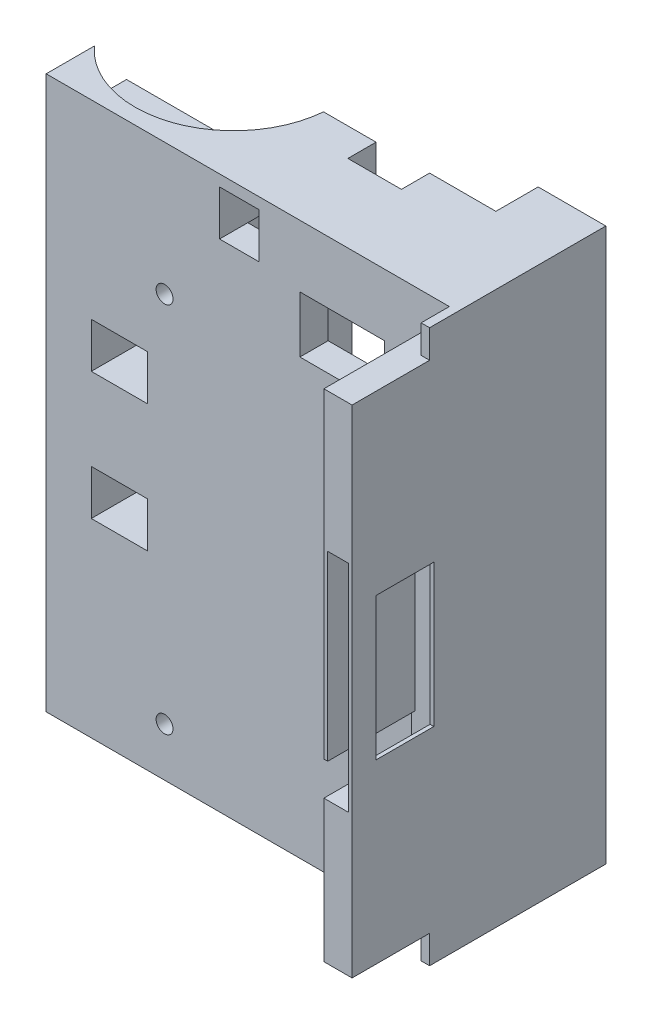
from build123d import *

# Parameters (mm, degrees)
SKETCH1_W           = 72
SKETCH1_H           = 26.25
BOSS_EXTRUDE1_DEPTH = 98
SKETCH3_W           = 24
SKETCH3_H           = 12
CUT_EXTRUDE2_DEPTH  = 98
SKETCH4_W           = 1
SKETCH4_H           = 14.25
BOSS_EXTRUDE2_DEPTH = 98
SKETCH8_R           = 17.5
CUT_EXTRUDE6_DEPTH  = 8
CUT_EXTRUDE7_START  = -8
SKETCH9_R           = 17.5
CUT_EXTRUDE7_DEPTH  = 8
SKETCH10_R          = 2.25
CUT_EXTRUDE8_DEPTH  = 4.25
SKETCH11_W          = 33
SKETCH11_H          = 67.5
CUT_EXTRUDE9_DEPTH  = 21.25
SKETCH12_W          = 33
SKETCH12_H          = 7.5
CUT_EXTRUDE10_DEPTH = 21.25
SKETCH13_W          = 9.5
SKETCH13_H          = 10
CUT_EXTRUDE11_DEPTH = 21.25
SKETCH14_W          = 5
SKETCH14_H          = 5
CUT_EXTRUDE13_DEPTH = 101.25
SKETCH17_W          = 7
SKETCH17_H          = 8
CUT_EXTRUDE14_DEPTH = 7
SKETCH18_W          = 5.398243629
SKETCH18_H          = 5.439982626
BOSS_EXTRUDE3_DEPTH = 2
SKETCH19_W          = 15
SKETCH19_H          = 15
CUT_EXTRUDE15_DEPTH = 12
SKETCH20_W          = 15.253773686
SKETCH20_H          = 5.298590198
BOSS_EXTRUDE5_DEPTH = 5
SKETCH22_R          = 1.5
CUT_EXTRUDE16_DEPTH = 8.2
SKETCH23_W          = 10
SKETCH23_H          = 8
CUT_EXTRUDE18_DEPTH = 125.988249448
SKETCH25_R          = 2.25
CUT_EXTRUDE20_DEPTH = 6.25
SKETCH26_W          = 7
SKETCH26_H          = 8
CUT_EXTRUDE21_DEPTH = 124.057913195
SKETCH28_W          = 7.366793482
SKETCH28_H          = 8.135980894
BOSS_EXTRUDE6_DEPTH = 2
SKETCH31_R          = 1.5
CUT_EXTRUDE24_DEPTH = 3.25
SKETCH32_W          = 5
SKETCH32_H          = 98
BOSS_EXTRUDE7_DEPTH = 18.75
SKETCH34_W          = 5
SKETCH34_H          = 5
CUT_EXTRUDE27_DEPTH = 13.75
SKETCH35_W          = 3.5
SKETCH35_H          = 5
CUT_EXTRUDE28_DEPTH = 5
SKETCH37_W          = 10.25
SKETCH37_H          = 25.25
CUT_EXTRUDE29_DEPTH = 3
SKETCH36_W          = 3.65
SKETCH36_H          = 38.25
CUT_EXTRUDE30_DEPTH = 15.5
SKETCH38_W          = 0.68
SKETCH38_H          = 6
CUT_EXTRUDE31_DEPTH = 15.5


with BuildPart() as part:
    # Sketch1 → Boss-Extrude1 (new body)
    with BuildSketch(Plane(origin=(0, 0, 0), x_dir=(1, 0, 0), z_dir=(0, 1, 0))):
        with Locations((-36, -13.125)):
            Rectangle(SKETCH1_W, SKETCH1_H)
    extrude(amount=BOSS_EXTRUDE1_DEPTH)

    # Sketch3 → Cut-Extrude2 (cut)
    with BuildSketch(Plane.XZ):
        with Locations((-60, 6)):
            Rectangle(SKETCH3_W, SKETCH3_H)
    extrude(amount=-CUT_EXTRUDE2_DEPTH, mode=Mode.SUBTRACT)

    # Sketch4 → Boss-Extrude2 (add)
    with BuildSketch(Plane(origin=(0, 0, 0), x_dir=(-1, 0, 0), z_dir=(0, -1, 0))):
        with Locations((72.5, -19.125)):
            Rectangle(SKETCH4_W, SKETCH4_H)
    extrude(amount=-BOSS_EXTRUDE2_DEPTH)

    # Sketch8 → Cut-Extrude6 (cut)
    with BuildSketch(Plane.XZ):
        with Locations((-60, 6)):
            Circle(SKETCH8_R)
    extrude(amount=-CUT_EXTRUDE6_DEPTH, mode=Mode.SUBTRACT)

    # Sketch9 → Cut-Extrude7 (cut)
    with BuildSketch(Plane(origin=(0, 98, 0), x_dir=(1, 0, 0), z_dir=(0, 1, 0)).offset(CUT_EXTRUDE7_START)):
        with Locations((-60, -6)):
            Circle(SKETCH9_R)
    extrude(amount=CUT_EXTRUDE7_DEPTH, mode=Mode.SUBTRACT)

    # Sketch10 → Cut-Extrude8 (cut)
    with BuildSketch(Plane(origin=(0, 0, 12), x_dir=(-1, 0, 0), z_dir=(0, 0, -1))):
        with Locations((69.25, 85)):
            Circle(SKETCH10_R)
        with Locations((50.75, 85)):
            Circle(SKETCH10_R)
        with Locations((69.25, 13)):
            Circle(SKETCH10_R)
        with Locations((50.75, 13)):
            Circle(SKETCH10_R)
    extrude(amount=-CUT_EXTRUDE8_DEPTH, mode=Mode.SUBTRACT)

    # Sketch11 → Cut-Extrude9 (cut)
    with BuildSketch(Plane(origin=(0, 0, 0), x_dir=(-1, 0, 0), z_dir=(0, 0, -1))):
        with Locations((28.5, 54.25)):
            Rectangle(SKETCH11_W, SKETCH11_H)
    extrude(amount=-CUT_EXTRUDE9_DEPTH, mode=Mode.SUBTRACT)

    # Sketch12 → Cut-Extrude10 (cut)
    with BuildSketch(Plane(origin=(0, 98, 0), x_dir=(1, 0, 0), z_dir=(0, 1, 0))):
        with Locations((-28.5, -3.75)):
            Rectangle(SKETCH12_W, SKETCH12_H)
    extrude(amount=-CUT_EXTRUDE10_DEPTH, mode=Mode.SUBTRACT)

    # Sketch13 → Cut-Extrude11 (cut)
    with BuildSketch(Plane(origin=(0, 98, 0), x_dir=(1, 0, 0), z_dir=(0, 1, 0))):
        with Locations((-28.5, -7.5)):
            Rectangle(SKETCH13_W, SKETCH13_H)
    extrude(amount=-CUT_EXTRUDE11_DEPTH, mode=Mode.SUBTRACT)

    # Sketch14 → Cut-Extrude13 (cut)
    with BuildSketch(Plane(origin=(0, 20.5, 0), x_dir=(1, 0, 0), z_dir=(0, 1, 0))):
        with Locations((-39.5, -12)):
            Rectangle(SKETCH14_W, SKETCH14_H)
    extrude(amount=CUT_EXTRUDE13_DEPTH, mode=Mode.SUBTRACT)

    # Sketch17 → Cut-Extrude14 (cut)
    with BuildSketch(Plane(origin=(0, 0, 7.5), x_dir=(-1, 0, 0), z_dir=(0, 0, -1))):
        with Locations((38.75, 92)):
            Rectangle(SKETCH17_W, SKETCH17_H)
    extrude(amount=-CUT_EXTRUDE14_DEPTH, mode=Mode.SUBTRACT)

    # Sketch18 → Boss-Extrude3 (add)
    with BuildSketch(Plane(origin=(0, 98, 0), x_dir=(1, 0, 0), z_dir=(0, 1, 0))):
        with Locations((-39.480706385, -11.994977786)):
            Rectangle(SKETCH18_W, SKETCH18_H)
    extrude(amount=-BOSS_EXTRUDE3_DEPTH)

    # Sketch19 → Cut-Extrude15 (cut)
    with BuildSketch(Plane.XY.offset(26.25)):
        with Locations((-20.5, 79.5)):
            Rectangle(SKETCH19_W, SKETCH19_H)
    extrude(amount=-CUT_EXTRUDE15_DEPTH, mode=Mode.SUBTRACT)

    # Sketch20 → Boss-Extrude5 (add)
    with BuildSketch(Plane.XY.offset(26.25)):
        with Locations((-20.373113157, 74.350704901)):
            Rectangle(SKETCH20_W, SKETCH20_H)
    extrude(amount=-BOSS_EXTRUDE5_DEPTH)

    # Sketch22 → Cut-Extrude16 (cut)
    with BuildSketch(Plane(origin=(0, 0, 0), x_dir=(-1, 0, 0), z_dir=(0, 0, -1))):
        with Locations((6, 55.73)):
            Circle(SKETCH22_R)
        with Locations((6, 42.27)):
            Circle(SKETCH22_R)
    extrude(amount=-CUT_EXTRUDE16_DEPTH, mode=Mode.SUBTRACT)

    # Sketch23 → Cut-Extrude18 (cut, through all)
    with BuildSketch(Plane.XY.offset(26.25)):
        with Locations((-60, 37.7)):
            Rectangle(SKETCH23_W, SKETCH23_H)
        with Locations((-60, 60.3)):
            Rectangle(SKETCH23_W, SKETCH23_H)
    extrude(amount=-CUT_EXTRUDE18_DEPTH, mode=Mode.SUBTRACT)

    # Sketch25 → Cut-Extrude20 (cut)
    with BuildSketch(Plane.ZY.offset(73)):
        with Locations((19.125, 77)):
            Circle(SKETCH25_R)
        with Locations((19.125, 49)):
            Circle(SKETCH25_R)
        with Locations((19.125, 21)):
            Circle(SKETCH25_R)
    extrude(amount=-CUT_EXTRUDE20_DEPTH, mode=Mode.SUBTRACT)

    # Sketch26 → Cut-Extrude21 (cut, through all)
    with BuildSketch(Plane(origin=(0, 0, 14.5), x_dir=(-1, 0, 0), z_dir=(0, 0, -1))):
        with Locations((38.75, 92)):
            Rectangle(SKETCH26_W, SKETCH26_H)
    extrude(amount=-CUT_EXTRUDE21_DEPTH, mode=Mode.SUBTRACT)

    # Sketch28 → Boss-Extrude6 (add)
    with BuildSketch(Plane(origin=(0, 0, 7.5), x_dir=(-1, 0, 0), z_dir=(0, 0, -1))):
        with Locations((38.749742444, 92.067990447)):
            Rectangle(SKETCH28_W, SKETCH28_H)
    extrude(amount=-BOSS_EXTRUDE6_DEPTH)

    # Sketch31 → Cut-Extrude24 (cut)
    with BuildSketch(Plane.XY.offset(26.25)):
        with Locations((-52.007752906, 74.651528785)):
            Circle(SKETCH31_R)
        with Locations((-9.007752906, 74.651528785)):
            Circle(SKETCH31_R)
        with Locations((-9.007752906, 8.625682812)):
            Circle(SKETCH31_R)
        with Locations((-52.007752906, 8.625682812)):
            Circle(SKETCH31_R)
    extrude(amount=-CUT_EXTRUDE24_DEPTH, mode=Mode.SUBTRACT)

    # Sketch32 → Boss-Extrude7 (add)
    with BuildSketch(Plane.XY.offset(26.25)):
        with Locations((-2.5, 49)):
            Rectangle(SKETCH32_W, SKETCH32_H)
    extrude(amount=BOSS_EXTRUDE7_DEPTH)

    # Sketch34 → Cut-Extrude27 (cut)
    with BuildSketch(Plane.XY.offset(45)):
        with Locations((-2.5, 95.5)):
            Rectangle(SKETCH34_W, SKETCH34_H)
        with Locations((-2.5, 2.5)):
            Rectangle(SKETCH34_W, SKETCH34_H)
    extrude(amount=-CUT_EXTRUDE27_DEPTH, mode=Mode.SUBTRACT)

    # Sketch35 → Cut-Extrude28 (cut)
    with BuildSketch(Plane.XY.offset(31.25)):
        with Locations((-3.25, 95.5)):
            Rectangle(SKETCH35_W, SKETCH35_H)
        with Locations((-3.25, 2.5)):
            Rectangle(SKETCH35_W, SKETCH35_H)
    extrude(amount=-CUT_EXTRUDE28_DEPTH, mode=Mode.SUBTRACT)

    # Sketch37 → Cut-Extrude29 (cut)
    with BuildSketch(Plane(origin=(0, 0, 0), x_dir=(0, 0, -1), z_dir=(1, 0, 0))):
        with Locations((-35.625, 49)):
            Rectangle(SKETCH37_W, SKETCH37_H)
    extrude(amount=-CUT_EXTRUDE29_DEPTH, mode=Mode.SUBTRACT)

    # Sketch36 → Cut-Extrude30 (cut)
    with BuildSketch(Plane.XY.offset(45)):
        with Locations((-2.5, 49.25)):
            Rectangle(SKETCH36_W, SKETCH36_H)
    extrude(amount=-CUT_EXTRUDE30_DEPTH, mode=Mode.SUBTRACT)

    # Sketch38 → Cut-Extrude31 (cut)
    with BuildSketch(Plane.XY.offset(45)):
        with Locations((-4.665, 33.125)):
            Rectangle(SKETCH38_W, SKETCH38_H)
    extrude(amount=-CUT_EXTRUDE31_DEPTH, mode=Mode.SUBTRACT)


solid = part.part
